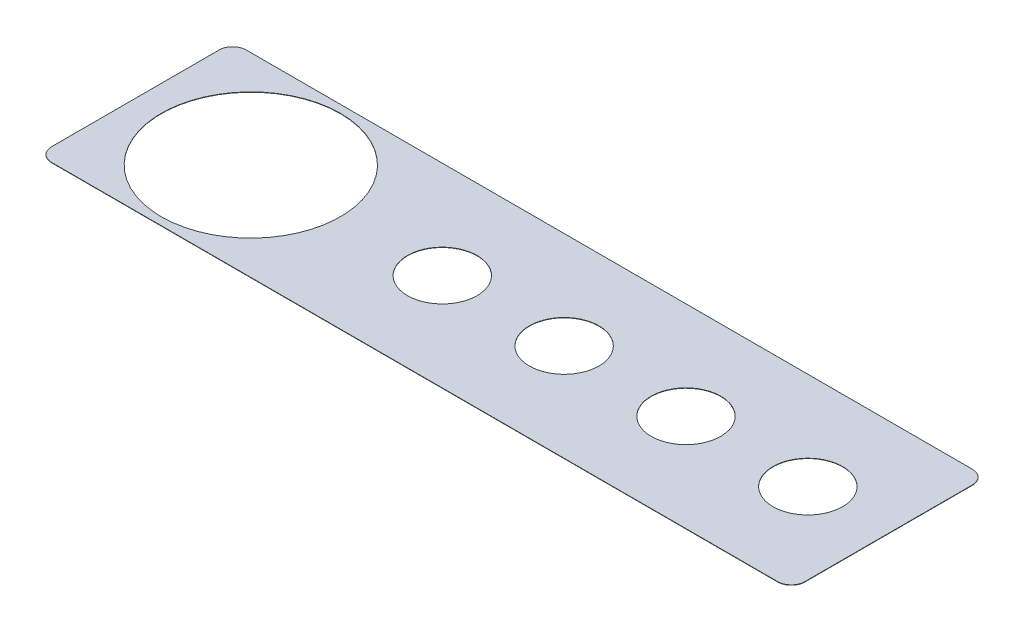
from build123d import *

# Parameters (mm, degrees)
SKETCH1_R               = 25.736334191
BOSS_EXTRUDE1_DEPTH     = 0.1
CUT_EXTRUDE1_DEPTH      = 147.870107232
CUT_EXTRUDE1_DEPTH_BACK = 147.870107232
SKETCH2_R               = 10


with BuildPart() as part:
    # Sketch1 → Boss-Extrude1 (new body)
    with BuildSketch(Plane(origin=(0, 0, 0), x_dir=(1, 0, 0), z_dir=(0, 1, 0))):
        with BuildLine():
            Line((-76.705846626, 6.628303893), (-76.705846626, -41.491355388))
            ThreePointArc((-76.705846626, -41.491355388), (-75.563563073, -44.249071834), (-72.805846626, -45.391355388))
            Line((-72.805846626, -45.391355388), (135.779788281, -45.391355388))
            ThreePointArc((135.779788281, -45.391355388), (138.537504728, -44.249071834), (139.679788281, -41.491355388))
            Line((139.679788281, -41.491355388), (139.679788281, 6.628303893))
            ThreePointArc((139.679788281, 6.628303893), (138.537504728, 9.386020339), (135.779788281, 10.528303893))
            Line((135.779788281, 10.528303893), (-72.805846626, 10.528303893))
            ThreePointArc((-72.805846626, 10.528303893), (-75.563563073, 9.386020339), (-76.705846626, 6.628303893))
        make_face()
        with Locations(Location((-43.538029172, -17.431525748, 0), (0, 0, 270))):
            Circle(SKETCH1_R, mode=Mode.SUBTRACT)
    extrude(amount=BOSS_EXTRUDE1_DEPTH)

    # Sketch2 → Cut-Extrude1 (cut, two sides: drawn at the far end of the back side and taken through both)
    with BuildSketch(Plane(origin=(0, 0.1, 0), x_dir=(1, 0, 0), z_dir=(0, 1, 0)).offset(-CUT_EXTRUDE1_DEPTH_BACK)):
        with Locations(Location((11.461970828, -17.431525748, 0), (0, 0, 270))):
            Circle(SKETCH2_R)
        with Locations(Location((46.461970828, -17.431525748, 0), (0, 0, 270))):
            Circle(SKETCH2_R)
        with Locations(Location((81.461970828, -17.431525748, 0), (0, 0, 270))):
            Circle(SKETCH2_R)
        with Locations(Location((116.461970828, -17.431525748, 0), (0, 0, 270))):
            Circle(SKETCH2_R)
    extrude(amount=CUT_EXTRUDE1_DEPTH + CUT_EXTRUDE1_DEPTH_BACK, mode=Mode.SUBTRACT)


solid = part.part
